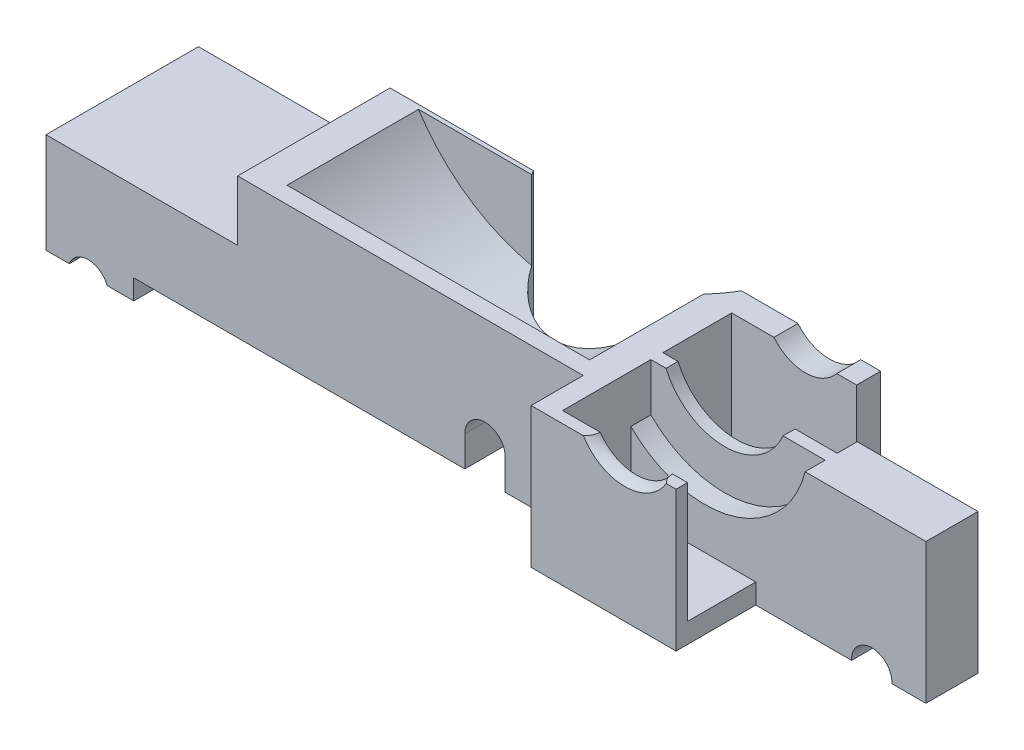
from build123d import *

# Parameters (mm, degrees)
SKETCH1_W           = 419.1
SKETCH1_H           = 142.18412
BOSS_EXTRUDE1_DEPTH = 88.9
SKETCH2_R           = 119.38
CUT_EXTRUDE1_DEPTH  = 83.4009
SKETCH7_W           = 187.160719179
SKETCH7_H           = 30.93974
SKETCH7_H_2         = 43.28668
CUT_EXTRUDE2_DEPTH  = 452.402640644
SKETCH4_R           = 40.386
CUT_EXTRUDE4_DEPTH  = 7.62
CUT_EXTRUDE17_START = -12.7
CUT_EXTRUDE17_DEPTH = 12.7
CUT_EXTRUDE18_DEPTH = 12.7
SKETCH18_R          = 25.527
CUT_EXTRUDE11_DEPTH = 23.09114
SKETCH8_W           = 419.1
SKETCH8_H           = 88.9
CUT_EXTRUDE6_DEPTH  = 7.85114
SKETCH9_W           = 419.1
SKETCH9_H           = 88.9
CUT_EXTRUDE7_DEPTH  = 7.14248
SKETCH10_W          = 219.202
SKETCH10_H          = 88.9
CUT_EXTRUDE8_DEPTH  = 30.48
SKETCH12_W          = 121.533574186
SKETCH12_H          = 96.7105
BOSS_EXTRUDE2_DEPTH = 50.8
SKETCH14_W          = 55.647095764
SKETCH14_H          = 96.7105
BOSS_EXTRUDE3_DEPTH = 12.7
CUT_EXTRUDE10_REACH = 448.907
SKETCH17_R          = 12.827
SKETCH22_W          = 199.898
SKETCH22_H          = 88.9
BOSS_EXTRUDE5_DEPTH = 2.54
SKETCH29_R          = 12.827
CUT_EXTRUDE14_DEPTH = 447.906526346
BOSS_EXTRUDE6_DEPTH = 86.10092
SKETCH45_W          = 107.95
SKETCH45_H          = 50.53076
SKETCH45_H_2        = 15.24
CUT_EXTRUDE22_DEPTH = 452.677672269
SKETCH46_W          = 91.948
SKETCH46_H          = 129.7305
BOSS_EXTRUDE7_DEPTH = 12.7
CUT_EXTRUDE23_DEPTH = 452.677672176


with BuildPart() as part:
    # Sketch1 → Boss-Extrude1 (new body)
    with BuildSketch(Plane(origin=(0, 0, 0), x_dir=(1, 0, 0), z_dir=(0, 1, 0))):
        with Locations((209.55, 71.09206)):
            Rectangle(SKETCH1_W, SKETCH1_H)
    extrude(amount=BOSS_EXTRUDE1_DEPTH)

    # Sketch2 → Cut-Extrude1 (cut)
    with BuildSketch(Plane(origin=(0, 0, -131.63296), x_dir=(-1, 0, 0), z_dir=(0, 0, -1))):
        with Locations((-116.7166499, 150.061217688)):
            Circle(SKETCH2_R)
    extrude(amount=-CUT_EXTRUDE1_DEPTH, mode=Mode.SUBTRACT)

    # Sketch7 → Cut-Extrude2 (cut, through all)
    with BuildSketch(Plane(origin=(0, 88.9, 0), x_dir=(1, 0, 0), z_dir=(0, 1, 0))):
        with Locations((325.519640411, 103.62311)):
            Rectangle(SKETCH7_W, SKETCH7_H)
        with Locations((325.519640411, 33.4899)):
            Rectangle(SKETCH7_W, SKETCH7_H_2)
    extrude(amount=-CUT_EXTRUDE2_DEPTH, mode=Mode.SUBTRACT)

    # Sketch4 → Cut-Extrude4 (cut)
    with BuildSketch(Plane(origin=(0, 0, -67.83324), x_dir=(-1, 0, 0), z_dir=(0, 0, -1))):
        with Locations((-278.649352085, 104.852009966)):
            Circle(SKETCH4_R)
    extrude(amount=CUT_EXTRUDE4_DEPTH, mode=Mode.SUBTRACT)

    # Sketch39 → Cut-Extrude17 (cut)
    with BuildSketch(Plane.XY.offset(-55.13324).offset(CUT_EXTRUDE17_START)):
        with BuildLine():
            Line((231.939280821, 58.527426444), (231.939280821, 88.9))
            Line((231.939280821, 88.9), (342.472006166, 88.9))
            ThreePointArc((342.472006166, 88.9), (296.080170447, 41.417284719), (231.939280821, 58.527426444))
        make_face()
    extrude(amount=CUT_EXTRUDE17_DEPTH, mode=Mode.SUBTRACT)

    # Sketch40 → Cut-Extrude18 (cut)
    with BuildSketch(Plane(origin=(0, 0, -88.15324), x_dir=(-1, 0, 0), z_dir=(0, 0, -1))):
        with BuildLine():
            Line((-231.939280821, 88.9), (-231.939280821, 58.527426444))
            ThreePointArc((-231.939280821, 58.527426444), (-296.080170447, 41.417284719), (-342.472006166, 88.9))
            Line((-342.472006166, 88.9), (-231.939280821, 88.9))
        make_face()
    extrude(amount=-CUT_EXTRUDE18_DEPTH, mode=Mode.SUBTRACT)

    # Sketch18 → Cut-Extrude11 (cut)
    with BuildSketch(Plane(origin=(0, 0, -142.18412), x_dir=(-1, 0, 0), z_dir=(0, 0, -1))):
        with Locations((-278.649352085, 104.852009966)):
            Circle(SKETCH18_R)
    extrude(amount=-CUT_EXTRUDE11_DEPTH, mode=Mode.SUBTRACT)

    # Sketch8 → Cut-Extrude6 (cut)
    with BuildSketch(Plane(origin=(0, 0, -142.18412), x_dir=(-1, 0, 0), z_dir=(0, 0, -1))):
        with Locations((-209.55, 44.45)):
            Rectangle(SKETCH8_W, SKETCH8_H)
    extrude(amount=-CUT_EXTRUDE6_DEPTH, mode=Mode.SUBTRACT)

    # Sketch9 → Cut-Extrude7 (cut)
    with BuildSketch(Plane.XY):
        with Locations((209.55, 44.45)):
            Rectangle(SKETCH9_W, SKETCH9_H)
    extrude(amount=-CUT_EXTRUDE7_DEPTH, mode=Mode.SUBTRACT)

    # Sketch10 → Cut-Extrude8 (cut)
    with BuildSketch(Plane.XY.offset(-7.14248)):
        with Locations((109.601, 44.45)):
            Rectangle(SKETCH10_W, SKETCH10_H)
    extrude(amount=-CUT_EXTRUDE8_DEPTH, mode=Mode.SUBTRACT)

    # Sketch12 → Boss-Extrude2 (add)
    with BuildSketch(Plane.XZ):
        with Locations((-60.766787093, -85.97773)):
            Rectangle(SKETCH12_W, SKETCH12_H)
    extrude(amount=-BOSS_EXTRUDE2_DEPTH)

    # Sketch14 → Boss-Extrude3 (add)
    with BuildSketch(Plane.XZ):
        with Locations((-93.710026304, -85.97773)):
            Rectangle(SKETCH14_W, SKETCH14_H)
    extrude(amount=BOSS_EXTRUDE3_DEPTH)

    # Cut-Extrude10: up to this face of the body (flat: up to its plane)
    cut_extrude10_end = Plane(part.part.faces().sort_by_distance((319.151, 44.45, -7.14248))[0])
    # Sketch17 → Cut-Extrude10 (cut, up to the picked face)
    with BuildSketch(Plane(origin=(0, 0, -134.33298), x_dir=(-1, 0, 0), z_dir=(0, 0, -1)), mode=Mode.PRIVATE) as cut_extrude10_sk1:
        with Locations((-384.735935495, 0.531880938)):
            Circle(SKETCH17_R)
    cut_extrude10_tool1 = split(extrude(cut_extrude10_sk1.sketch, amount=-CUT_EXTRUDE10_REACH, mode=Mode.PRIVATE), bisect_by=cut_extrude10_end, keep=Keep.BOTH, mode=Mode.PRIVATE)
    # Sketch17 → Cut-Extrude10 (cut, up to the picked face)
    with BuildSketch(Plane(origin=(0, 0, -134.33298), x_dir=(-1, 0, 0), z_dir=(0, 0, -1)), mode=Mode.PRIVATE) as cut_extrude10_sk2:
        with Locations((94.798916194, -17.274045482)):
            Circle(SKETCH17_R)
    cut_extrude10_tool2 = split(extrude(cut_extrude10_sk2.sketch, amount=-CUT_EXTRUDE10_REACH, mode=Mode.PRIVATE), bisect_by=cut_extrude10_end, keep=Keep.BOTH, mode=Mode.PRIVATE)
    # Sketch17 → Cut-Extrude10 (cut, up to the picked face)
    with BuildSketch(Plane(origin=(0, 0, -134.33298), x_dir=(-1, 0, 0), z_dir=(0, 0, -1)), mode=Mode.PRIVATE) as cut_extrude10_sk3:
        with BuildLine():
            Line((-169.736021607, 19.31637742), (-169.736021607, 0))
            Line((-169.736021607, 0), (-144.082021607, 0))
            Line((-144.082021607, 0), (-144.082021607, 19.31637742))
            ThreePointArc((-144.082021607, 19.31637742), (-156.909021607, 32.14337742), (-169.736021607, 19.31637742))
        make_face()
    cut_extrude10_tool3 = split(extrude(cut_extrude10_sk3.sketch, amount=-CUT_EXTRUDE10_REACH, mode=Mode.PRIVATE), bisect_by=cut_extrude10_end, keep=Keep.BOTH, mode=Mode.PRIVATE)
    add(cut_extrude10_tool1.solids().sort_by(Axis((384.735935, 0.531881, -134.33298), (0, 0, 1)))[0], mode=Mode.SUBTRACT)
    add(cut_extrude10_tool2.solids().sort_by(Axis((-94.798916, -17.274045, -134.33298), (0, 0, 1)))[0], mode=Mode.SUBTRACT)
    add(cut_extrude10_tool3.solids().sort_by(Axis((156.909022, 14.834778, -134.33298), (0, 0, 1)))[0], mode=Mode.SUBTRACT)

    # Sketch22 → Boss-Extrude5 (add)
    with BuildSketch(Plane.XY.offset(-7.14248)):
        with Locations((319.151, 44.45)):
            Rectangle(SKETCH22_W, SKETCH22_H)
    extrude(amount=BOSS_EXTRUDE5_DEPTH)

    # Sketch29 → Cut-Extrude14 (cut, through all)
    with BuildSketch(Plane(origin=(0, 0, -7.14248), x_dir=(-1, 0, 0), z_dir=(0, 0, -1))):
        with Locations((-384.735935495, 0.531880938)):
            Circle(SKETCH29_R)
    extrude(amount=-CUT_EXTRUDE14_DEPTH, mode=Mode.SUBTRACT)

    # Sketch30 → Boss-Extrude6 (add)
    with BuildSketch(Plane(origin=(0, 0, -134.33298), x_dir=(-1, 0, 0), z_dir=(0, 0, -1))):
        with BuildLine():
            Line((-14.194018979, 88.9), (-20.758717893, 88.9))
            ThreePointArc((-20.758717893, 88.9), (-116.7166499, 36.269217688), (-212.674581906, 88.9))
            Line((-212.674581906, 88.9), (-219.239280821, 88.9))
            ThreePointArc((-219.239280821, 88.9), (-116.7166499, 30.681217688), (-14.194018979, 88.9))
        make_face()
    extrude(amount=-BOSS_EXTRUDE6_DEPTH)

    # Sketch44 → Cut-Revolve1 (revolve, cut)
    with BuildSketch(Plane(origin=(0, 104.852009966, 0), x_dir=(1, 0, 0), z_dir=(0, 1, 0))):
        with BuildLine():
            Line((278.649352085, 11.84656), (306.589352085, 11.84656))
            ThreePointArc((306.589352085, 11.84656), (307.31205993, 7.964449393), (309.383352085, 4.60248))
            Line((309.383352085, 4.60248), (278.649352085, 4.60248))
            Line((278.649352085, 4.60248), (278.649352085, 11.84656))
        make_face()
    revolve(axis=Axis((278.649352085, 104.852009966, -328.456473898), (0, 0, 1)), mode=Mode.SUBTRACT)

    # Sketch45 → Cut-Extrude22 (cut, through all)
    with BuildSketch(Plane(origin=(0, 88.9, 0), x_dir=(1, 0, 0), z_dir=(0, 1, 0))):
        with Locations((365.125, 29.86786)):
            Rectangle(SKETCH45_W, SKETCH45_H)
        with Locations((365.125, 126.71298)):
            Rectangle(SKETCH45_W, SKETCH45_H_2)
    extrude(amount=-CUT_EXTRUDE22_DEPTH, mode=Mode.SUBTRACT)

    # Sketch46 → Boss-Extrude7 (add)
    with BuildSketch(Plane.XZ):
        with Locations((265.176, -69.46773)):
            Rectangle(SKETCH46_W, SKETCH46_H)
    extrude(amount=-BOSS_EXTRUDE7_DEPTH)

    # Sketch47 → Cut-Extrude23 (cut, through all)
    with BuildSketch(Plane(origin=(0, 88.9, 0), x_dir=(1, 0, 0), z_dir=(0, 1, 0))):
        with BuildLine():
            Line((222.900157375, 134.33298), (90.917885838, 134.33298))
            ThreePointArc((90.917885838, 134.33298), (156.909021607, 96.23298), (222.900157375, 134.33298))
        make_face()
    extrude(amount=-CUT_EXTRUDE23_DEPTH, mode=Mode.SUBTRACT)


solid = part.part
